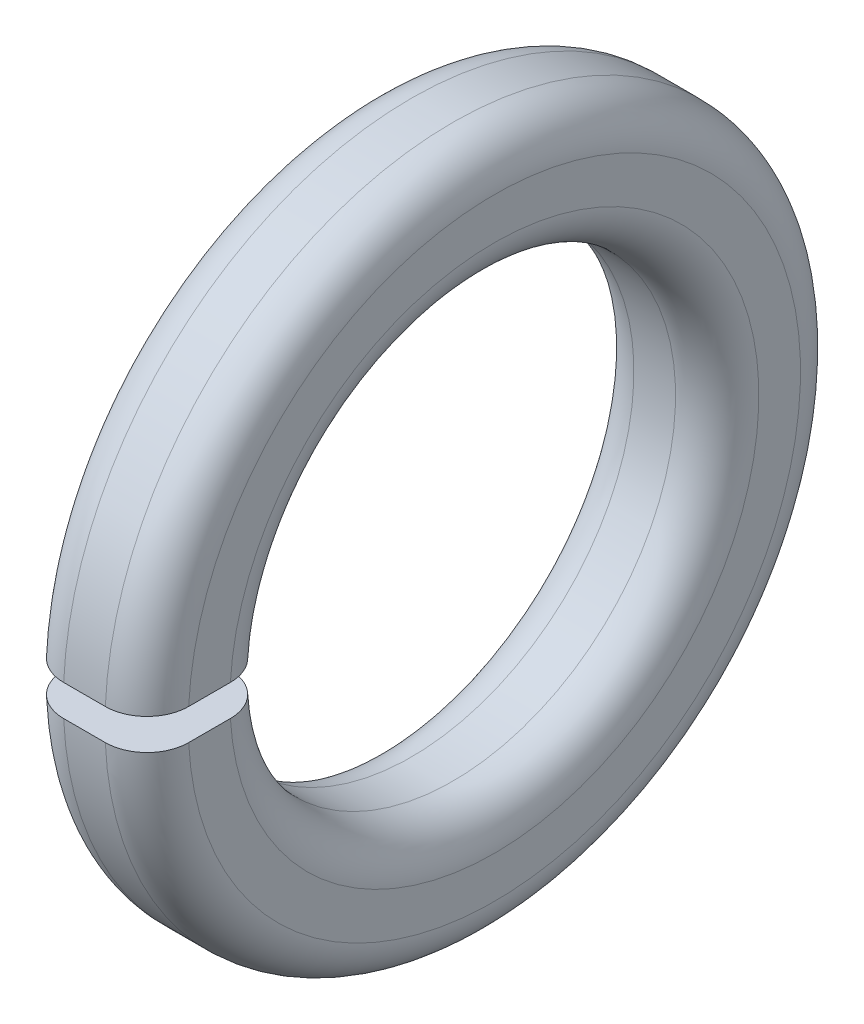
from build123d import *

# Parameters (mm, degrees)
SKETCH2_W = 0.375
SKETCH2_H = 4.2585
GAP_DEPTH = 7.091900429


with BuildPart() as part:
    # Sketch1 → Base-Revolve (revolve)
    with BuildSketch(Plane.XY, mode=Mode.PRIVATE) as base_revolve_sk:
        with BuildLine():
            Line((0, 3.175), (0, 3.675))
            ThreePointArc((0, 3.675), (-0.146446609, 4.028553391), (-0.5, 4.175))
            Line((-0.5, 4.175), (-1, 4.175))
            ThreePointArc((-1, 4.175), (-1.353553391, 4.028553391), (-1.5, 3.675))
            Line((-1.5, 3.675), (-1.5, 3.175))
            ThreePointArc((-1.5, 3.175), (-1.353553391, 2.821446609), (-1, 2.675))
            Line((-1, 2.675), (-0.5, 2.675))
            ThreePointArc((-0.5, 2.675), (-0.146446609, 2.821446609), (0, 3.175))
        make_face()
    revolve(base_revolve_sk.sketch.rotate(Axis((-34.925, 0, 0), (1, 0, 0)), 90), axis=Axis((-34.925, 0, 0), (1, 0, 0)))

    # Sketch2 → Gap (cut, through all)
    with BuildSketch(Plane(origin=(0, 0, 0), x_dir=(0, -1, 0), z_dir=(-1, 0, 0))):
        with Locations((0, 2.12925)):
            Rectangle(SKETCH2_W, SKETCH2_H)
    extrude(amount=GAP_DEPTH, mode=Mode.SUBTRACT)


solid = part.part
